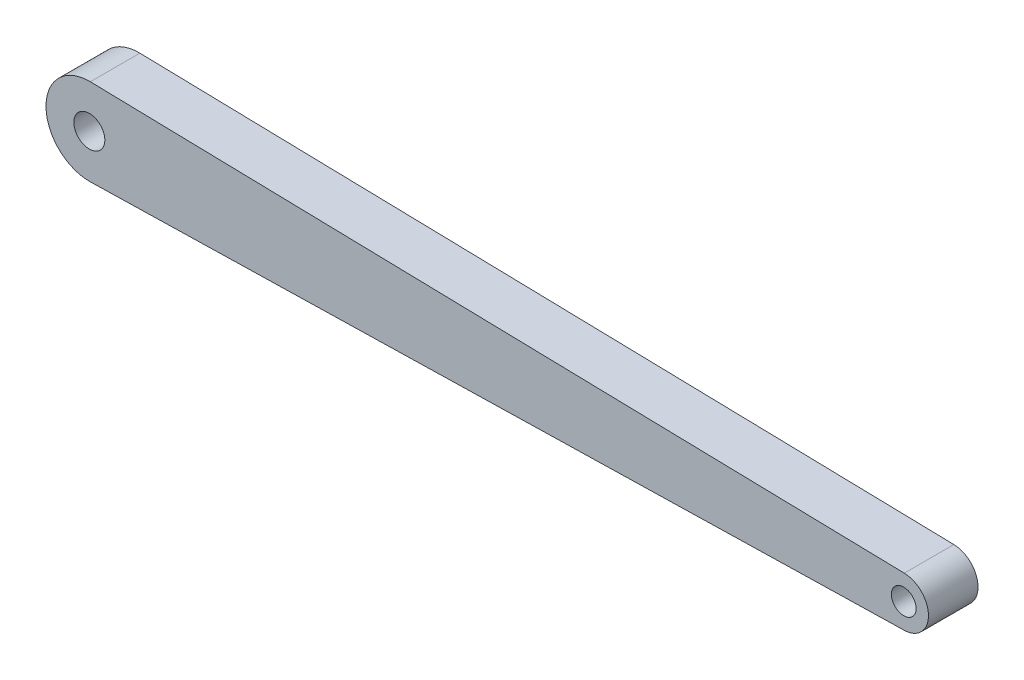
from build123d import *

# Parameters (mm, degrees)
SKETCH1_R           = 20
SKETCH1_R_2         = 25
BOSS_EXTRUDE1_DEPTH = 40


with BuildPart() as part:
    # Sketch1 → Boss-Extrude1 (new, symmetric)
    with BuildSketch(Plane.XY):
        with BuildLine():
            Line((-1313.403041825, 69.981781376), (0.912547529, 39.989589358))
            ThreePointArc((0.912547529, 39.989589358), (40, 0), (0.912547529, -39.989589358))
            Line((0.912547529, -39.989589358), (-1313.403041825, -69.981781376))
            ThreePointArc((-1313.403041825, -69.981781376), (-1385, 0), (-1313.403041825, 69.981781376))
        make_face()
        Circle(SKETCH1_R, mode=Mode.SUBTRACT)
        with Locations((-1315, 0)):
            Circle(SKETCH1_R_2, mode=Mode.SUBTRACT)
    extrude(amount=BOSS_EXTRUDE1_DEPTH, both=True)


solid = part.part
